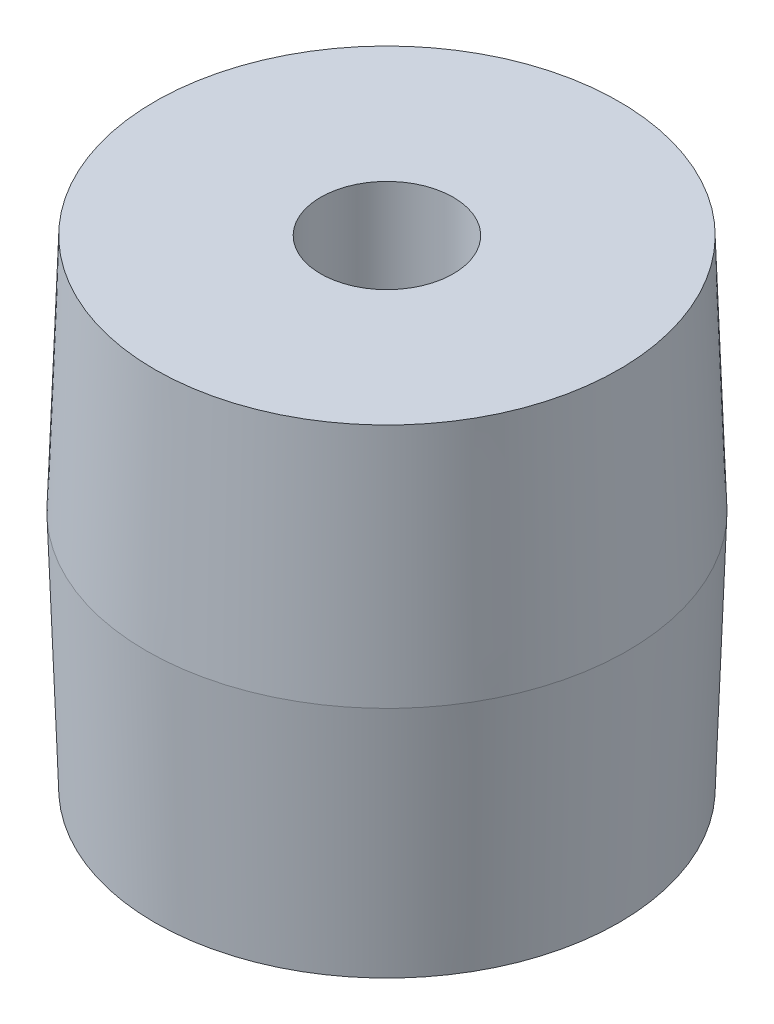
from build123d import *

# Parameters (mm, degrees)
SKETCH1_R           = 9.2075
BOSS_EXTRUDE1_DEPTH = 9.1694
BOSS_EXTRUDE1_TAPER = 2
SKETCH2_R           = 2.54
CUT_EXTRUDE1_DEPTH  = 23.491502958


with BuildPart() as part:
    # Sketch1 → Boss-Extrude1 (new body)
    with BuildSketch(Plane(origin=(0, 0, 0), x_dir=(1, 0, 0), z_dir=(0, 1, 0))):
        Circle(SKETCH1_R)
    boss_extrude1 = extrude(amount=BOSS_EXTRUDE1_DEPTH, taper=BOSS_EXTRUDE1_TAPER)

    # Mirror1: Boss-Extrude1 across plane
    add(boss_extrude1.mirror(Plane.ZX))

    # Sketch2 → Cut-Extrude1 (cut, through all)
    with BuildSketch(Plane(origin=(0, -9.1694, 0), x_dir=(-1, 0, 0), z_dir=(0, -1, 0))):
        with Locations(Location((0, 0, 0), (0, 0, 90))):
            Circle(SKETCH2_R)
    extrude(amount=-CUT_EXTRUDE1_DEPTH, mode=Mode.SUBTRACT)


solid = part.part
